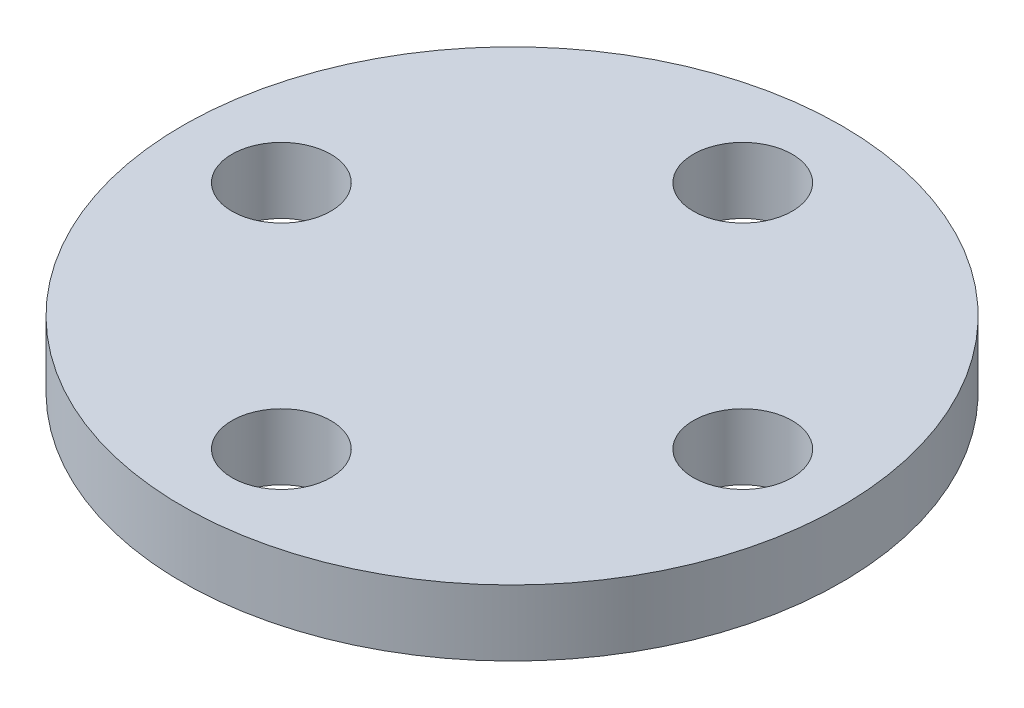
from build123d import *

# Parameters (mm, degrees)
CUT_EXTRUDE_1_REACH = 16.841
SKETCH_2_R          = 1.5


with BuildPart() as part:
    # 草图1 → 旋转1 (revolve)
    with BuildSketch(Plane.XY, mode=Mode.PRIVATE) as revolve_1_sk:
        Polygon((0, 4.5), (-10, 4.5), (-10, 2.5), (-4.5, 2.5), (-4.5, 0), (-2.75, 0), (-2.75, 3.5), (0, 3.5), align=None)
    revolve(revolve_1_sk.sketch.rotate(Axis((0, 0, 0), (0, 1, 0)), 270), axis=Axis((0, 0, 0), (0, 1, 0)))

    # 草图2 → 切除-拉伸1 (cut, up to next)
    with BuildSketch(Plane(origin=(0, 4.5, 0), x_dir=(1, 0, 0), z_dir=(0, 1, 0)), mode=Mode.PRIVATE) as cut_extrude_1_sk1:
        with Locations(Location((0, 7, 0), (0, 0, 270))):
            Circle(SKETCH_2_R)
    cut_extrude_1_tool1 = extrude(cut_extrude_1_sk1.sketch, amount=-CUT_EXTRUDE_1_REACH, mode=Mode.PRIVATE) & part.part
    # 草图2 → 切除-拉伸1 (cut, up to next)
    with BuildSketch(Plane(origin=(0, 4.5, 0), x_dir=(1, 0, 0), z_dir=(0, 1, 0)), mode=Mode.PRIVATE) as cut_extrude_1_sk2:
        with Locations(Location((7, 0, 0), (0, 0, 270))):
            Circle(SKETCH_2_R)
    cut_extrude_1_tool2 = extrude(cut_extrude_1_sk2.sketch, amount=-CUT_EXTRUDE_1_REACH, mode=Mode.PRIVATE) & part.part
    # 草图2 → 切除-拉伸1 (cut, up to next)
    with BuildSketch(Plane(origin=(0, 4.5, 0), x_dir=(1, 0, 0), z_dir=(0, 1, 0)), mode=Mode.PRIVATE) as cut_extrude_1_sk3:
        with Locations(Location((0, -7, 0), (0, 0, 270))):
            Circle(SKETCH_2_R)
    cut_extrude_1_tool3 = extrude(cut_extrude_1_sk3.sketch, amount=-CUT_EXTRUDE_1_REACH, mode=Mode.PRIVATE) & part.part
    # 草图2 → 切除-拉伸1 (cut, up to next)
    with BuildSketch(Plane(origin=(0, 4.5, 0), x_dir=(1, 0, 0), z_dir=(0, 1, 0)), mode=Mode.PRIVATE) as cut_extrude_1_sk4:
        with Locations(Location((-7, 0, 0), (0, 0, 270))):
            Circle(SKETCH_2_R)
    cut_extrude_1_tool4 = extrude(cut_extrude_1_sk4.sketch, amount=-CUT_EXTRUDE_1_REACH, mode=Mode.PRIVATE) & part.part
    add(cut_extrude_1_tool1.solids().sort_by_distance((0, 4.5, -7))[0], mode=Mode.SUBTRACT)
    add(cut_extrude_1_tool2.solids().sort_by_distance((7, 4.5, 0))[0], mode=Mode.SUBTRACT)
    add(cut_extrude_1_tool3.solids().sort_by_distance((0, 4.5, 7))[0], mode=Mode.SUBTRACT)
    add(cut_extrude_1_tool4.solids().sort_by_distance((-7, 4.5, 0))[0], mode=Mode.SUBTRACT)


solid = part.part
